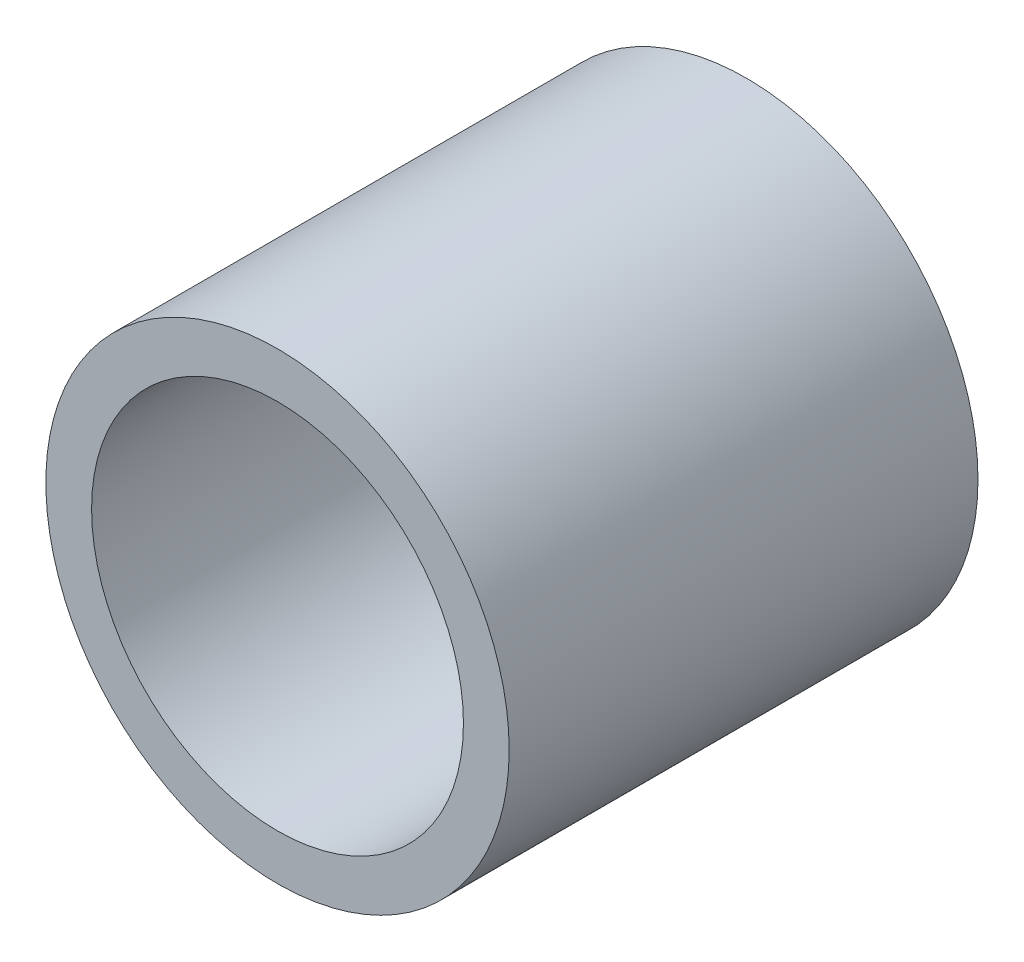
from build123d import *

# Parameters (mm, degrees)
SKETCH1_R           = 5.065
SKETCH1_R_2         = 4.065
BOSS_EXTRUDE1_DEPTH = 10.25


with BuildPart() as part:
    # Sketch1 → Boss-Extrude1 (new body)
    with BuildSketch(Plane.XY):
        Circle(SKETCH1_R)
        Circle(SKETCH1_R_2, mode=Mode.SUBTRACT)
    extrude(amount=BOSS_EXTRUDE1_DEPTH)


solid = part.part
